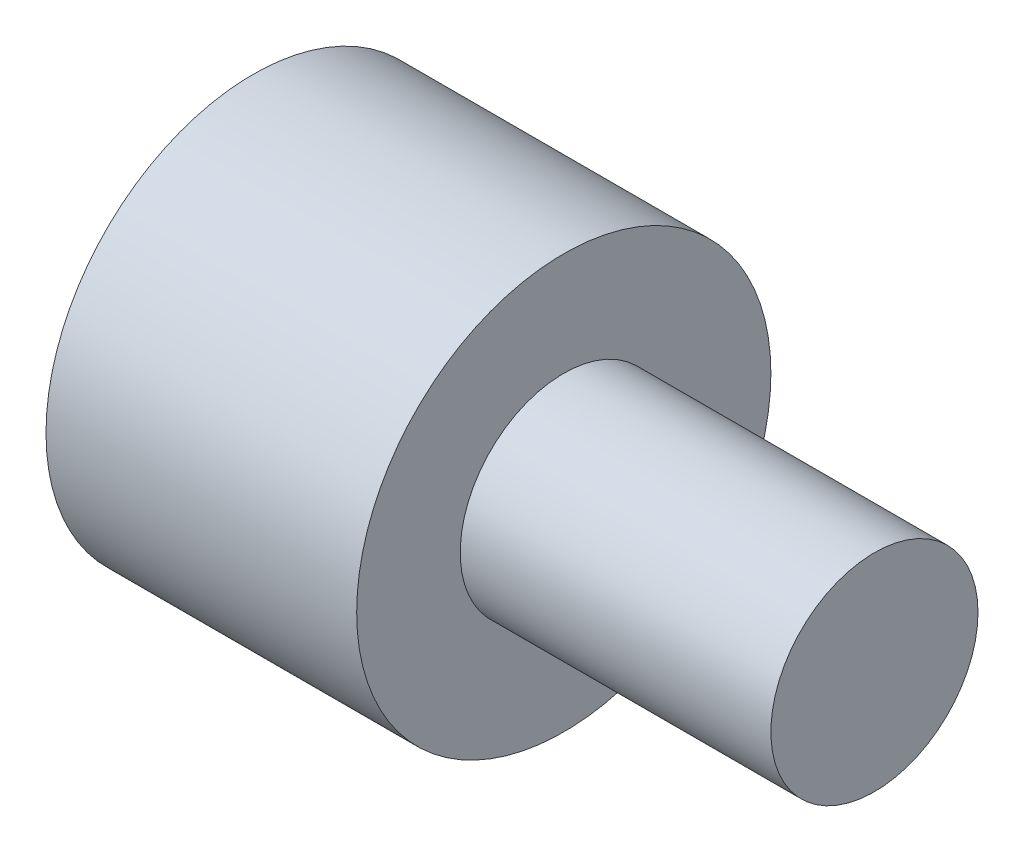
from build123d import *

# Parameters (mm, degrees)
SKETCH1_R           = 20
BOSS_EXTRUDE1_DEPTH = 30
SKETCH2_R           = 10
BOSS_EXTRUDE2_DEPTH = 30


with BuildPart() as part:
    # Sketch1 → Boss-Extrude1 (new body)
    with BuildSketch(Plane(origin=(0, 0, 0), x_dir=(0, 0, -1), z_dir=(1, 0, 0))):
        Circle(SKETCH1_R)
    extrude(amount=BOSS_EXTRUDE1_DEPTH)

    # Sketch2 → Boss-Extrude2 (add)
    with BuildSketch(Plane(origin=(30, 0, 0), x_dir=(0, 0, -1), z_dir=(1, 0, 0))):
        Circle(SKETCH2_R)
    extrude(amount=BOSS_EXTRUDE2_DEPTH)


solid = part.part
